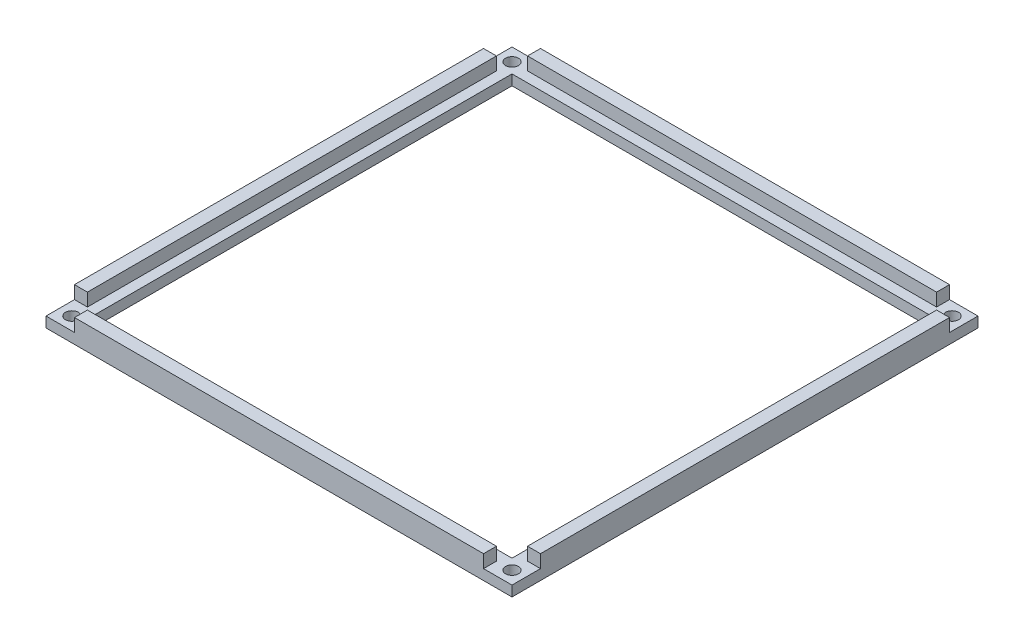
from build123d import *

# Parameters (mm, degrees)
CROQUIS1_W              = 200
CROQUIS1_H              = 200
CROQUIS1_R              = 2.5
SALIENTE_EXTRUIR1_DEPTH = 4
CROQUIS2_W              = 158
CROQUIS2_H              = 158
CORTAR_EXTRUIR1_DEPTH   = 10
CROQUIS3_W              = 200
CROQUIS3_H              = 200
CROQUIS3_W_2            = 180
CROQUIS3_H_2            = 180
CORTAR_EXTRUIR2_DEPTH   = 10
CROQUIS4_W              = 158
CROQUIS4_H              = 5
CROQUIS4_W_2            = 5
CROQUIS4_H_2            = 158
SALIENTE_EXTRUIR2_DEPTH = 5
CROQUIS5_W              = 162
CROQUIS5_H              = 162
CROQUIS5_W_2            = 158
CROQUIS5_H_2            = 158
CORTAR_EXTRUIR4_DEPTH   = 5


with BuildPart() as part:
    # Croquis1 → Saliente-Extruir1 (new body)
    with BuildSketch(Plane(origin=(0, 0, 0), x_dir=(1, 0, 0), z_dir=(0, 1, 0))):
        with Locations((100, 100)):
            Rectangle(CROQUIS1_W, CROQUIS1_H)
        with Locations(Location((15, 185, 0), (0, 0, 270))):
            Circle(CROQUIS1_R, mode=Mode.SUBTRACT)
        with Locations(Location((185, 185, 0), (0, 0, 270))):
            Circle(CROQUIS1_R, mode=Mode.SUBTRACT)
        with Locations(Location((185, 15, 0), (0, 0, 270))):
            Circle(CROQUIS1_R, mode=Mode.SUBTRACT)
        with Locations(Location((15, 15, 0), (0, 0, 270))):
            Circle(CROQUIS1_R, mode=Mode.SUBTRACT)
    extrude(amount=SALIENTE_EXTRUIR1_DEPTH)

    # Croquis2 → Cortar-Extruir1 (cut)
    with BuildSketch(Plane(origin=(0, 4, 0), x_dir=(1, 0, 0), z_dir=(0, 1, 0))):
        with Locations((100, 100)):
            Rectangle(CROQUIS2_W, CROQUIS2_H)
    extrude(amount=-CORTAR_EXTRUIR1_DEPTH, mode=Mode.SUBTRACT)

    # Croquis3 → Cortar-Extruir2 (cut)
    with BuildSketch(Plane(origin=(0, 4, 0), x_dir=(1, 0, 0), z_dir=(0, 1, 0))):
        with Locations((100, 100)):
            Rectangle(CROQUIS3_W, CROQUIS3_H)
        with Locations((100, 100)):
            Rectangle(CROQUIS3_W_2, CROQUIS3_H_2, mode=Mode.SUBTRACT)
    extrude(amount=-CORTAR_EXTRUIR2_DEPTH, mode=Mode.SUBTRACT)

    # Croquis4 → Saliente-Extruir2 (add)
    with BuildSketch(Plane(origin=(0, 4, 0), x_dir=(1, 0, 0), z_dir=(0, 1, 0))):
        with Locations((100, 187.5)):
            Rectangle(CROQUIS4_W, CROQUIS4_H)
        with Locations((187.5, 100)):
            Rectangle(CROQUIS4_W_2, CROQUIS4_H_2)
        with Locations((100, 12.5)):
            Rectangle(CROQUIS4_W, CROQUIS4_H)
        with Locations((12.5, 100)):
            Rectangle(CROQUIS4_W_2, CROQUIS4_H_2)
    extrude(amount=SALIENTE_EXTRUIR2_DEPTH)

    # Croquis5 → Cortar-Extruir4 (cut)
    with BuildSketch(Plane(origin=(0, 4, 0), x_dir=(1, 0, 0), z_dir=(0, 1, 0))):
        with Locations((100, 100)):
            Rectangle(CROQUIS5_W, CROQUIS5_H)
        with Locations((100, 100)):
            Rectangle(CROQUIS5_W_2, CROQUIS5_H_2, mode=Mode.SUBTRACT)
    extrude(amount=-CORTAR_EXTRUIR4_DEPTH, mode=Mode.SUBTRACT)


solid = part.part
